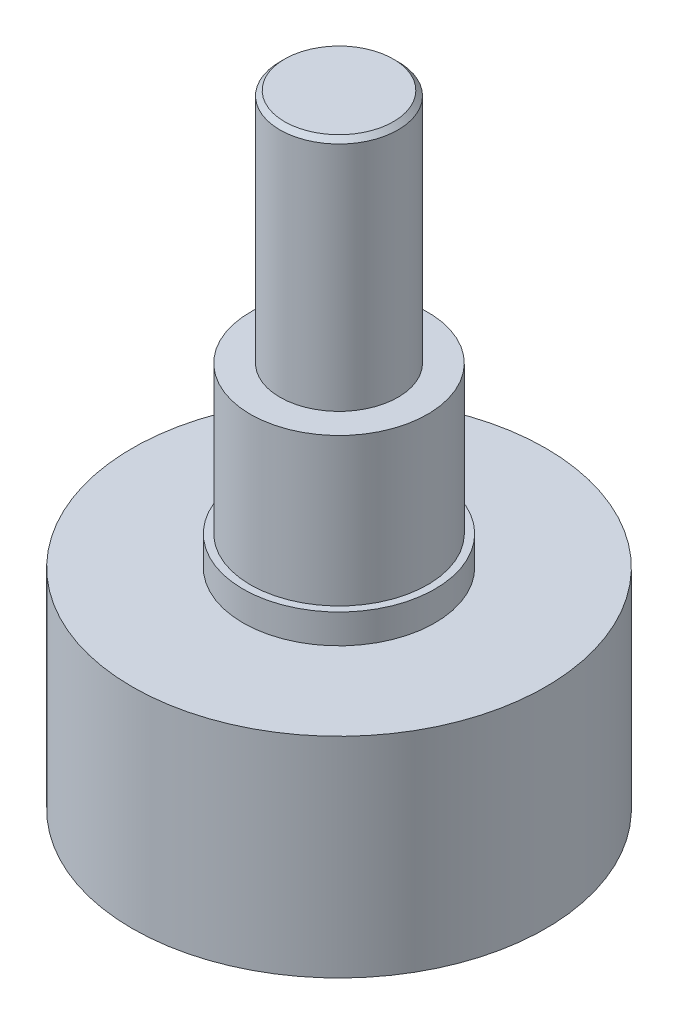
from build123d import *

# Parameters (mm, degrees)
SKETCH1_R           = 11.1125
BOSS_EXTRUDE1_DEPTH = 11.2522
SKETCH3_R           = 5.15874
BOSS_EXTRUDE2_DEPTH = 1.5748
SKETCH4_R           = 4.7625
BOSS_EXTRUDE3_DEPTH = 7.9375
SKETCH5_R           = 3.175
BOSS_EXTRUDE4_DEPTH = 12.7
CHAMFER1_SIZE       = 0.254


with BuildPart() as part:
    # Sketch1 → Boss-Extrude1 (new body)
    with BuildSketch(Plane(origin=(0, 0, 0), x_dir=(1, 0, 0), z_dir=(0, 1, 0))):
        with Locations(Location((0, 0, 0), (0, 0, 270))):
            Circle(SKETCH1_R)
    extrude(amount=BOSS_EXTRUDE1_DEPTH)

    # Sketch3 → Boss-Extrude2 (add)
    with BuildSketch(Plane(origin=(0, 11.2522, 0), x_dir=(1, 0, 0), z_dir=(0, 1, 0))):
        with Locations(Location((0, 0, 0), (0, 0, 270))):
            Circle(SKETCH3_R)
    extrude(amount=BOSS_EXTRUDE2_DEPTH)

    # Sketch4 → Boss-Extrude3 (add)
    with BuildSketch(Plane(origin=(0, 12.827, 0), x_dir=(1, 0, 0), z_dir=(0, 1, 0))):
        with Locations(Location((0, 0, 0), (0, 0, 270))):
            Circle(SKETCH4_R)
    extrude(amount=BOSS_EXTRUDE3_DEPTH)

    # Sketch5 → Boss-Extrude4 (add)
    with BuildSketch(Plane(origin=(0, 20.7645, 0), x_dir=(1, 0, 0), z_dir=(0, 1, 0))):
        with Locations(Location((0, 0, 0), (0, 0, 270))):
            Circle(SKETCH5_R)
    extrude(amount=BOSS_EXTRUDE4_DEPTH)

    # Chamfer1
    chamfer1_edges = [part.edges().sort_by_distance(p)[0] for p in [
        (0, 33.4645, -3.175),
    ]]
    chamfer(chamfer1_edges, length=CHAMFER1_SIZE)


solid = part.part
